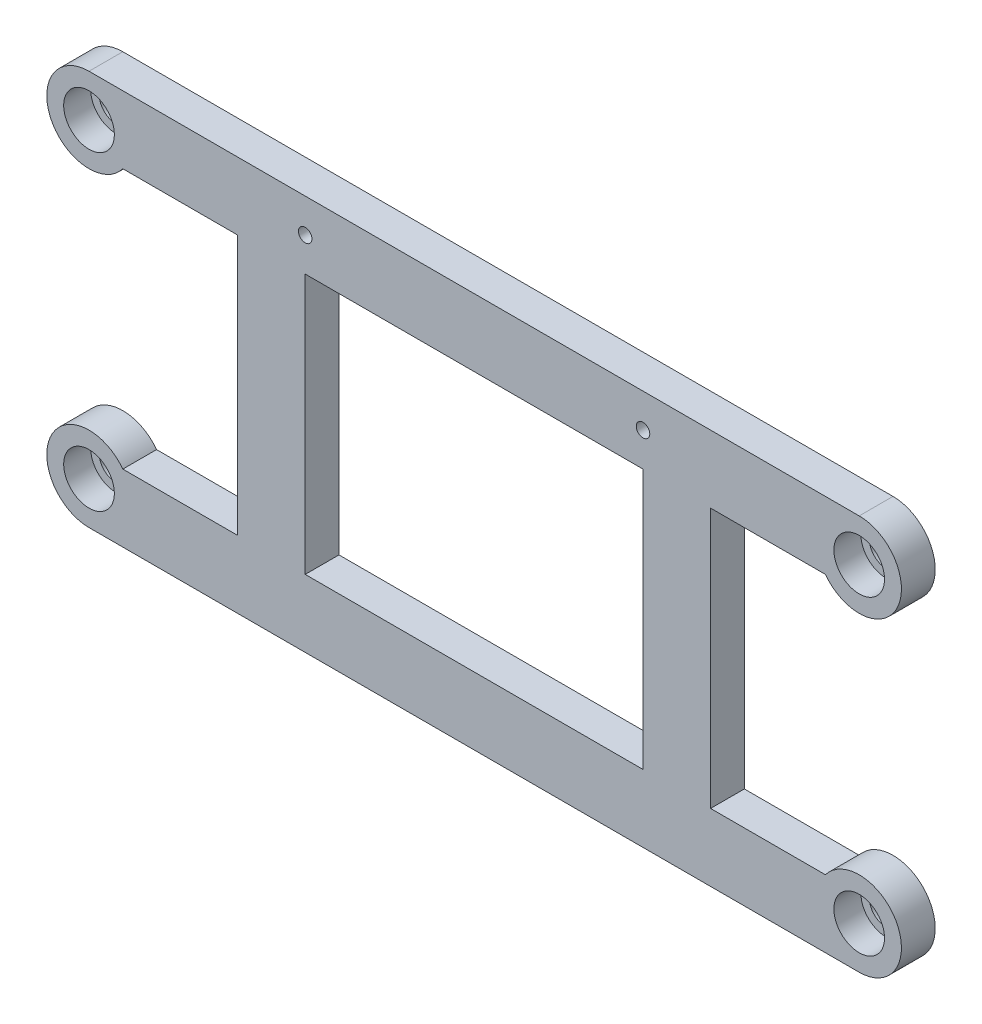
from build123d import *

# Parameters (mm, degrees)
SKETCH_1_R          = 5
SKETCH_1_W          = 100
SKETCH_1_H          = 77
EXTRUDE_1_DEPTH     = 10
SKETCH_3_R          = 7.5
CUT_EXTRUDE_1_DEPTH = 8
CUT_EXTRUDE_2_REACH = 166.385
SKETCH_5_R          = 2


with BuildPart() as part:
    # 草图1 → 凸台-拉伸1 (new body)
    with BuildSketch(Plane.XY):
        with BuildLine():
            Line((-104, 84.5), (-70, 84.5))
            Line((-70, 84.5), (-70, 7.5))
            Line((-70, 7.5), (-104, 7.5))
            ThreePointArc((-104, 7.5), (-125.180339887, 5.590169944), (-114, -12.5))
            Line((-114, -12.5), (114, -12.5))
            ThreePointArc((114, -12.5), (125.180339887, 5.590169944), (104, 7.5))
            Line((104, 7.5), (70, 7.5))
            Line((70, 7.5), (70, 84.5))
            Line((70, 84.5), (104, 84.5))
            ThreePointArc((104, 84.5), (125.180339887, 86.409830056), (114, 104.5))
            Line((114, 104.5), (64, 104.5))
            Line((64, 104.5), (-64, 104.5))
            Line((-64, 104.5), (-114, 104.5))
            ThreePointArc((-114, 104.5), (-125.180339887, 86.409830056), (-104, 84.5))
        make_face()
        with Locations((-114, 0)):
            Circle(SKETCH_1_R, mode=Mode.SUBTRACT)
        with Locations((-114, 92)):
            Circle(SKETCH_1_R, mode=Mode.SUBTRACT)
        with Locations(Location((114, 92, 0), (0, 0, 180))):
            Circle(SKETCH_1_R, mode=Mode.SUBTRACT)
        with Locations(Location((114, 0, 0), (0, 0, 180))):
            Circle(SKETCH_1_R, mode=Mode.SUBTRACT)
        with Locations((0, 46)):
            Rectangle(SKETCH_1_W, SKETCH_1_H, mode=Mode.SUBTRACT)
    extrude(amount=EXTRUDE_1_DEPTH)

    # 草图3 → 切除-拉伸1 (cut)
    with BuildSketch(Plane.XY.offset(10)):
        with Locations((-114, 92)):
            Circle(SKETCH_3_R)
        with Locations((-114, 0)):
            Circle(SKETCH_3_R)
        with Locations(Location((114, 0, 0), (0, 0, 180))):
            Circle(SKETCH_3_R)
        with Locations(Location((114, 92, 0), (0, 0, 180))):
            Circle(SKETCH_3_R)
    extrude(amount=-CUT_EXTRUDE_1_DEPTH, mode=Mode.SUBTRACT)

    # 草图5 → 切除-拉伸2 (cut, up to next)
    with BuildSketch(Plane.XY, mode=Mode.PRIVATE) as cut_extrude_2_sk1:
        with Locations(Location((-50, 94.5, 0), (0, 0, 180))):
            Circle(SKETCH_5_R)
    cut_extrude_2_tool1 = extrude(cut_extrude_2_sk1.sketch, amount=CUT_EXTRUDE_2_REACH, mode=Mode.PRIVATE) & part.part
    # 草图5 → 切除-拉伸2 (cut, up to next)
    with BuildSketch(Plane.XY, mode=Mode.PRIVATE) as cut_extrude_2_sk2:
        with Locations(Location((50, 94.5, 0), (0, 0, 180))):
            Circle(SKETCH_5_R)
    cut_extrude_2_tool2 = extrude(cut_extrude_2_sk2.sketch, amount=CUT_EXTRUDE_2_REACH, mode=Mode.PRIVATE) & part.part
    add(cut_extrude_2_tool1.solids().sort_by_distance((-50, 94.5, 0))[0], mode=Mode.SUBTRACT)
    add(cut_extrude_2_tool2.solids().sort_by_distance((50, 94.5, 0))[0], mode=Mode.SUBTRACT)


solid = part.part
